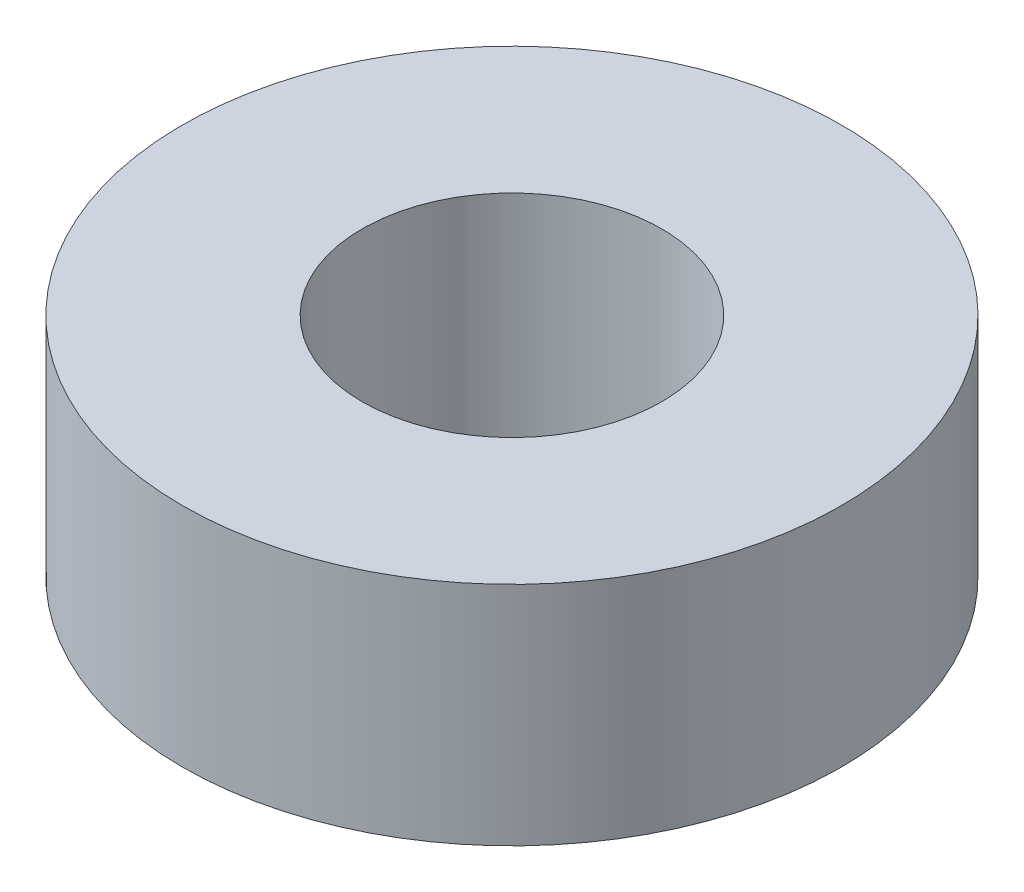
from build123d import *

# Parameters (mm, degrees)
SKETCH1_R           = 17.4625
SKETCH1_R_2         = 7.9375
BOSS_EXTRUDE1_DEPTH = 12


with BuildPart() as part:
    # Sketch1 → Boss-Extrude1 (new body)
    with BuildSketch(Plane(origin=(0, 0, 0), x_dir=(1, 0, 0), z_dir=(0, 1, 0))):
        with Locations(Location((0, 0, 0), (0, 0, 270))):
            Circle(SKETCH1_R)
        with Locations(Location((0, 0, 0), (0, 0, 270))):
            Circle(SKETCH1_R_2, mode=Mode.SUBTRACT)
    extrude(amount=BOSS_EXTRUDE1_DEPTH)


solid = part.part
